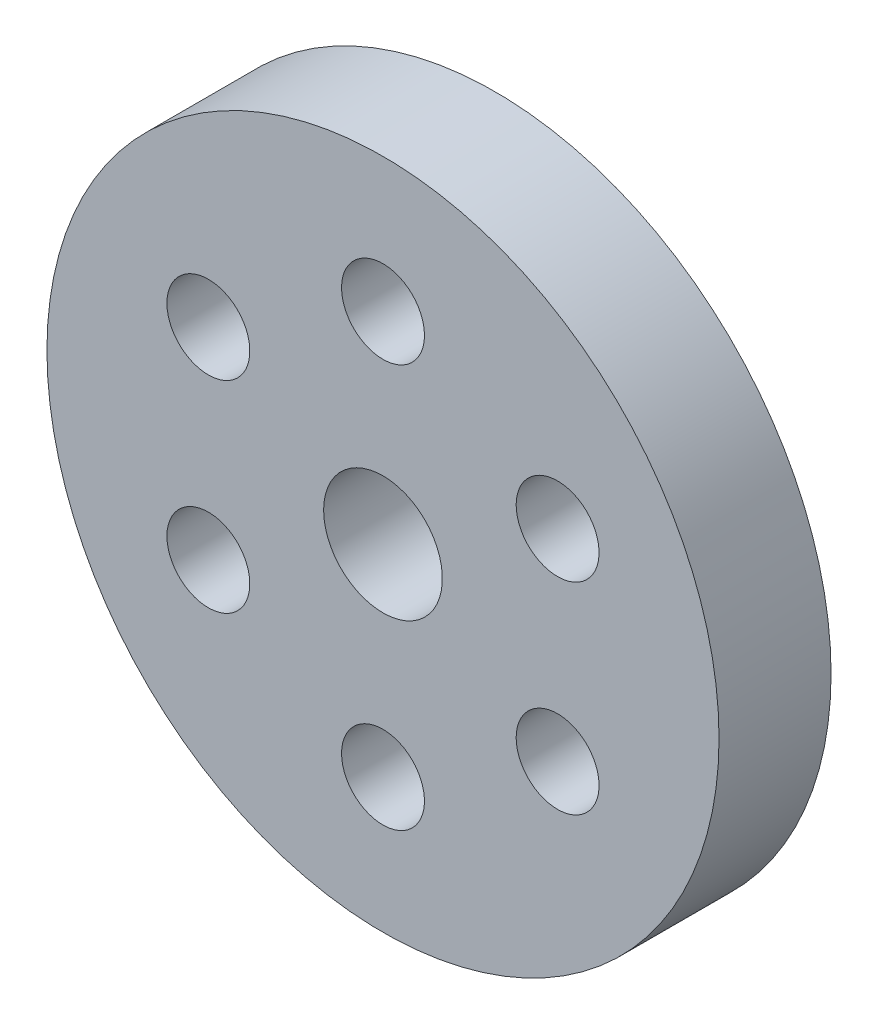
from build123d import *

# Parameters (mm, degrees)
SKETCH_1_R               = 15
EXTRUDE_1_DEPTH          = 5
HOLE_WIZARD_M5_1_D       = 5.3
HOLE_WIZARD_M3_5_1_D     = 3.7
PATTERN_CIRCULAR_1_COUNT = 6


with BuildPart() as part:
    # ｽｹｯﾁ1 → ﾎﾞｽ - 押し出し1 (new body)
    with BuildSketch(Plane.XY):
        Circle(SKETCH_1_R)
    extrude(amount=EXTRUDE_1_DEPTH)

    # M5 すきま穴1 (through all)
    with Locations(Plane(origin=(0, 0, 0), x_dir=(-1, 0, 0), z_dir=(0, 0, -1))):
        with Locations((0, 0)):
            Hole(HOLE_WIZARD_M5_1_D / 2)

    # M3.5 すきま穴1 (through all)
    with Locations(Plane(origin=(0, 9, 0), x_dir=(-1, 0, 0), z_dir=(0, 0, -1))):
        with Locations((0, 0)):
            hole_wizard_m3_5_1 = Hole(HOLE_WIZARD_M3_5_1_D / 2)

    # 円形ﾊﾟﾀｰﾝ1: M3.5 すきま穴1 ×6 about axis
    pattern_circular_1_axis = Axis((0, 0, 0), (0, 0, 1))
    for i in range(1, PATTERN_CIRCULAR_1_COUNT):
        add(hole_wizard_m3_5_1.rotate(pattern_circular_1_axis, i * 360 / PATTERN_CIRCULAR_1_COUNT), mode=Mode.SUBTRACT)


solid = part.part
